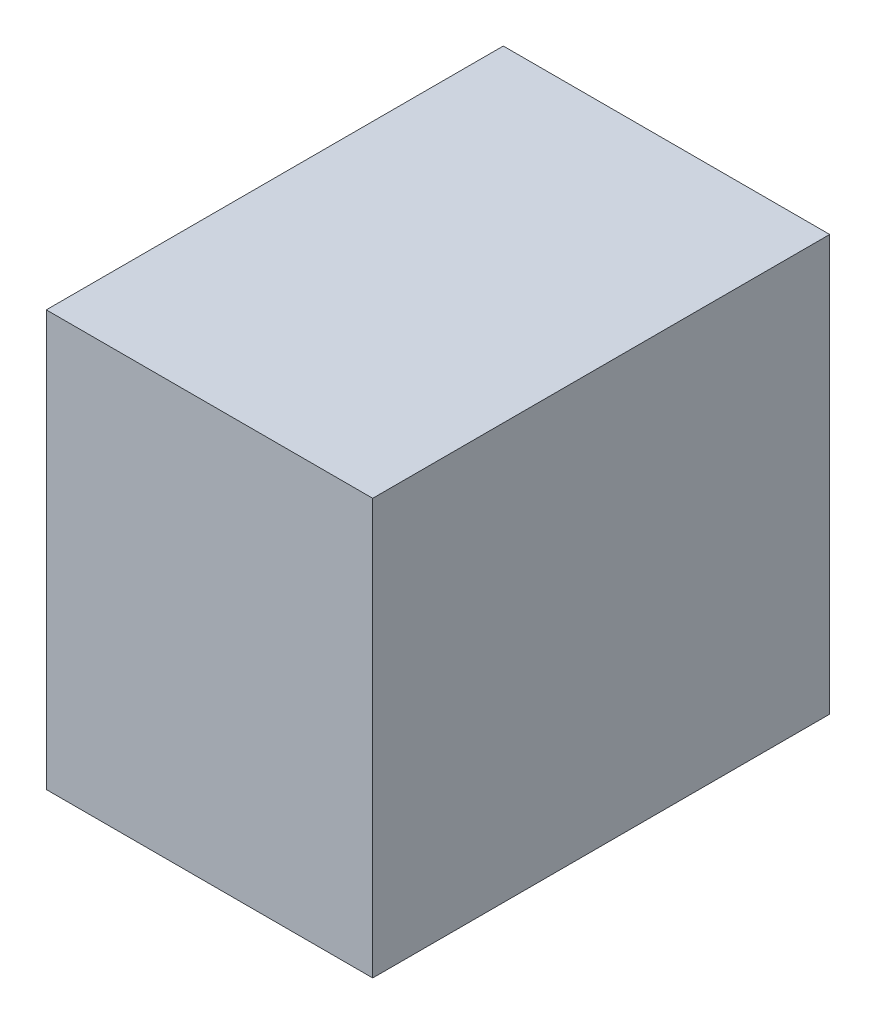
from build123d import *

# Parameters (mm, degrees)
SKETCH1_W           = 77
SKETCH1_H           = 70
BOSS_EXTRUDE1_DEPTH = 55
SKETCH3_W           = 35
SKETCH3_H           = 50
CUT_EXTRUDE1_DEPTH  = 57


with BuildPart() as part:
    # Sketch1 → Boss-Extrude1 (new body)
    with BuildSketch(Plane(origin=(0, 0, 0), x_dir=(0, 0, -1), z_dir=(1, 0, 0))):
        Rectangle(SKETCH1_W, SKETCH1_H)
    extrude(amount=BOSS_EXTRUDE1_DEPTH)

    # Sketch3 → Cut-Extrude1 (cut)
    with BuildSketch(Plane.XY.offset(28.5)):
        with Locations((27.5, 0)):
            Rectangle(SKETCH3_W, SKETCH3_H)
    extrude(amount=-CUT_EXTRUDE1_DEPTH, mode=Mode.SUBTRACT)


solid = part.part
